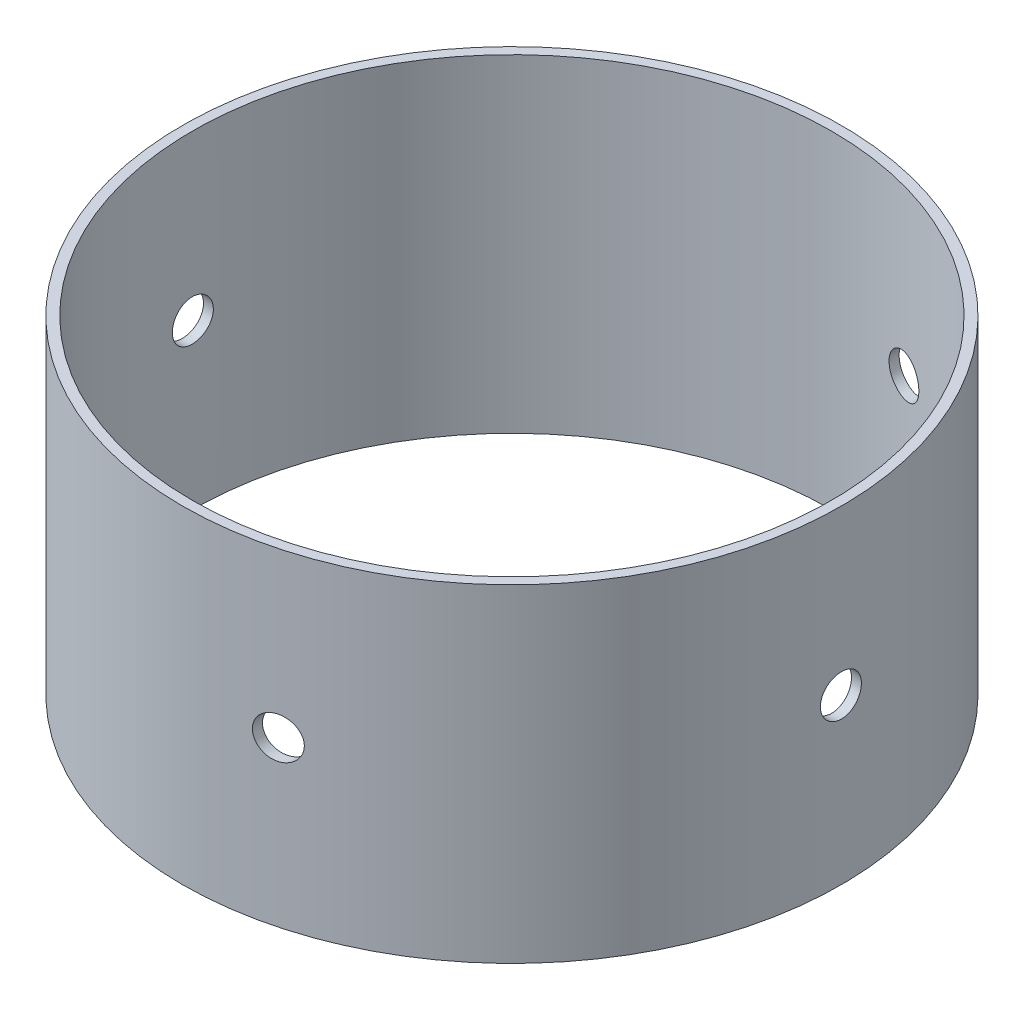
from build123d import *

# Parameters (mm, degrees)
SKETCH1_R               = 51.054
SKETCH1_R_2             = 49.53
BOSS_EXTRUDE1_DEPTH     = 50.8
CUT_EXTRUDE1_DEPTH      = 89.281718561
CUT_EXTRUDE1_DEPTH_BACK = 89.281718561
SKETCH2_R               = 3.175
CUT_EXTRUDE2_DEPTH      = 89.281718734
CUT_EXTRUDE2_DEPTH_BACK = 89.281718734
SKETCH3_R               = 3.175


with BuildPart() as part:
    # Sketch1 → Boss-Extrude1 (new body)
    with BuildSketch(Plane(origin=(0, 0, 0), x_dir=(1, 0, 0), z_dir=(0, 1, 0))):
        with Locations(Location((0, 0, 0), (0, 0, 270))):
            Circle(SKETCH1_R)
        with Locations(Location((0, 0, 0), (0, 0, 270))):
            Circle(SKETCH1_R_2, mode=Mode.SUBTRACT)
    extrude(amount=BOSS_EXTRUDE1_DEPTH)

    # Sketch2 → Cut-Extrude1 (cut, two sides: drawn at the far end of the back side and taken through both)
    with BuildSketch(Plane.XY.offset(-CUT_EXTRUDE1_DEPTH_BACK)):
        with Locations((13.06576, 25.4)):
            Circle(SKETCH2_R)
    extrude(amount=CUT_EXTRUDE1_DEPTH + CUT_EXTRUDE1_DEPTH_BACK, mode=Mode.SUBTRACT)

    # Sketch3 → Cut-Extrude2 (cut, two sides: drawn at the far end of the back side and taken through both)
    with BuildSketch(Plane(origin=(0, 0, 0), x_dir=(0, 0, -1), z_dir=(1, 0, 0)).offset(-CUT_EXTRUDE2_DEPTH_BACK)):
        with Locations((0, 25.4)):
            Circle(SKETCH3_R)
    extrude(amount=CUT_EXTRUDE2_DEPTH + CUT_EXTRUDE2_DEPTH_BACK, mode=Mode.SUBTRACT)


solid = part.part
